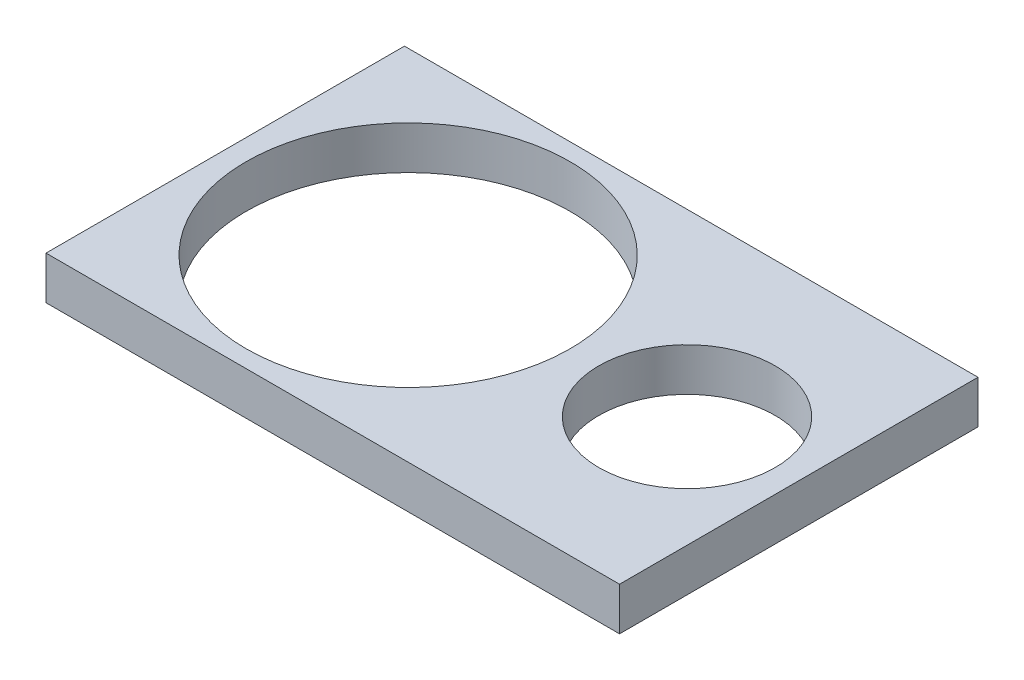
from build123d import *

# Parameters (mm, degrees)
SKETCH1_W           = 40
SKETCH1_H           = 25
BOSS_EXTRUDE1_DEPTH = 3
SKETCH2_R           = 11.3
SKETCH2_R_2         = 6.15
CUT_EXTRUDE1_DEPTH  = 24.774986856


with BuildPart() as part:
    # Sketch1 → Boss-Extrude1 (new body)
    with BuildSketch(Plane(origin=(0, 0, 0), x_dir=(1, 0, 0), z_dir=(0, 1, 0))):
        Rectangle(SKETCH1_W, SKETCH1_H)
    extrude(amount=BOSS_EXTRUDE1_DEPTH)

    # Sketch2 → Cut-Extrude1 (cut, through all)
    with BuildSketch(Plane(origin=(0, 3, 0), x_dir=(1, 0, 0), z_dir=(0, 1, 0))):
        with Locations(Location((-7.244052775, 0, 0), (0, 0, 270))):
            Circle(SKETCH2_R)
        with Locations(Location((12.233925016, -0.028743504, 0), (0, 0, 270))):
            Circle(SKETCH2_R_2)
    extrude(amount=-CUT_EXTRUDE1_DEPTH, mode=Mode.SUBTRACT)


solid = part.part
